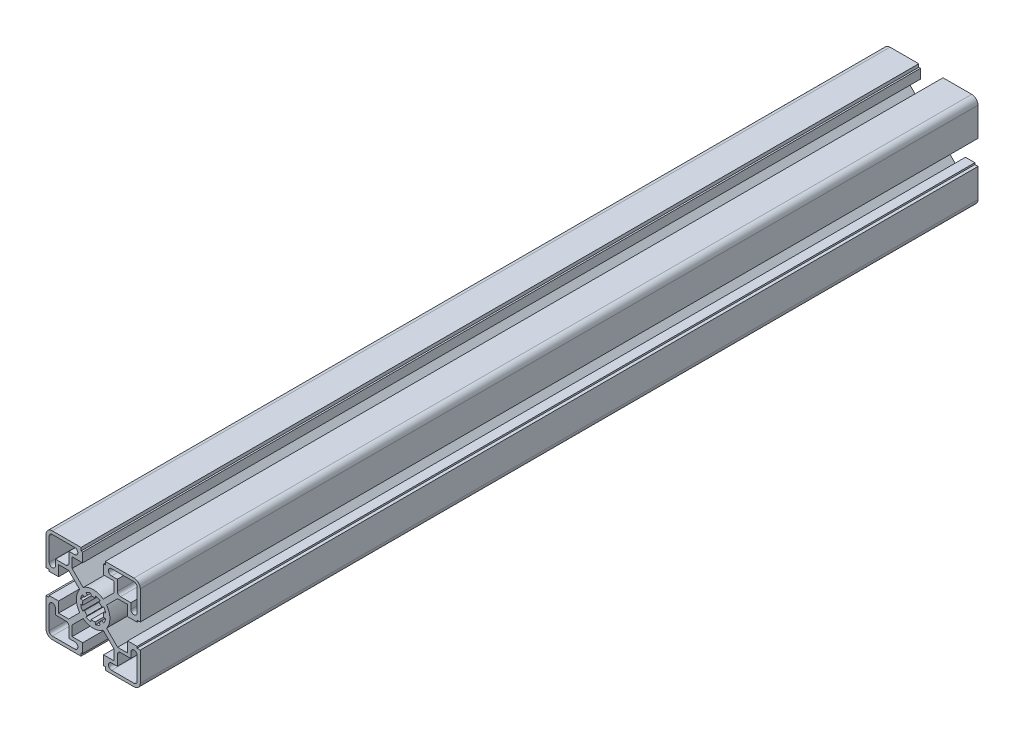
from build123d import *

# Parameters (mm, degrees)
BOSS_EXTRUDE1_DEPTH = 200


with BuildPart() as part:
    # Sketch1 → Boss-Extrude1 (new, symmetric)
    with BuildSketch(Plane.XY):
        with BuildLine():
            Line((-19.5072, 22.5044), (-5.7912, 22.5044))
            Line((-5.7912, 22.5044), (-5.7912, 21.0058))
            Line((-5.7912, 21.0058), (-5.0038, 21.0058))
            Line((-5.0038, 21.0058), (-5.0038, 16.51))
            Line((-5.0038, 16.51), (-10.0457, 16.51))
            Line((-10.0457, 16.51), (-10.0457, 11.680106614))
            Line((-10.0457, 11.680106614), (-4.781026704, 6.415433318))
            ThreePointArc((-4.781026704, 6.415433318), (0, 8.001), (4.781026704, 6.415433318))
            Line((4.781026704, 6.415433318), (10.0457, 11.680106614))
            Line((10.0457, 11.680106614), (10.0457, 16.51))
            Line((10.0457, 16.51), (5.0038, 16.51))
            Line((5.0038, 16.51), (5.0038, 21.0058))
            Line((5.0038, 21.0058), (5.7912, 21.0058))
            Line((5.7912, 21.0058), (5.7912, 22.5044))
            Line((5.7912, 22.5044), (19.5072, 22.5044))
            ThreePointArc((19.5072, 22.5044), (21.626540445, 21.626540445), (22.5044, 19.5072))
            Line((22.5044, 19.5072), (22.5044, 5.7912))
            Line((22.5044, 5.7912), (21.0058, 5.7912))
            Line((21.0058, 5.7912), (21.0058, 5.0038))
            Line((21.0058, 5.0038), (16.51, 5.0038))
            Line((16.51, 5.0038), (16.51, 10.0457))
            Line((16.51, 10.0457), (11.680106614, 10.0457))
            Line((11.680106614, 10.0457), (6.415433318, 4.781026704))
            ThreePointArc((6.415433318, 4.781026704), (8.001, 0), (6.415433318, -4.781026704))
            Line((6.415433318, -4.781026704), (11.680106614, -10.0457))
            Line((11.680106614, -10.0457), (16.51, -10.0457))
            Line((16.51, -10.0457), (16.51, -5.0038))
            Line((16.51, -5.0038), (21.0058, -5.0038))
            Line((21.0058, -5.0038), (21.0058, -5.7912))
            Line((21.0058, -5.7912), (22.5044, -5.7912))
            Line((22.5044, -5.7912), (22.5044, -19.5072))
            ThreePointArc((22.5044, -19.5072), (21.626540445, -21.626540445), (19.5072, -22.5044))
            Line((19.5072, -22.5044), (5.7912, -22.5044))
            Line((5.7912, -22.5044), (5.7912, -21.0058))
            Line((5.7912, -21.0058), (5.0038, -21.0058))
            Line((5.0038, -21.0058), (5.0038, -16.51))
            Line((5.0038, -16.51), (10.0457, -16.51))
            Line((10.0457, -16.51), (10.0457, -11.680106614))
            Line((10.0457, -11.680106614), (4.781026704, -6.415433318))
            ThreePointArc((4.781026704, -6.415433318), (0, -8.001), (-4.781026704, -6.415433318))
            Line((-4.781026704, -6.415433318), (-10.0457, -11.680106614))
            Line((-10.0457, -11.680106614), (-10.0457, -16.51))
            Line((-10.0457, -16.51), (-5.0038, -16.51))
            Line((-5.0038, -16.51), (-5.0038, -21.0058))
            Line((-5.0038, -21.0058), (-5.7912, -21.0058))
            Line((-5.7912, -21.0058), (-5.7912, -22.5044))
            Line((-5.7912, -22.5044), (-19.5072, -22.5044))
            ThreePointArc((-19.5072, -22.5044), (-21.626540445, -21.626540445), (-22.5044, -19.5072))
            Line((-22.5044, -19.5072), (-22.5044, -5.7912))
            Line((-22.5044, -5.7912), (-21.0058, -5.7912))
            Line((-21.0058, -5.7912), (-21.0058, -5.0038))
            Line((-21.0058, -5.0038), (-16.51, -5.0038))
            Line((-16.51, -5.0038), (-16.51, -10.0457))
            Line((-16.51, -10.0457), (-11.680106614, -10.0457))
            Line((-11.680106614, -10.0457), (-6.415433318, -4.781026704))
            ThreePointArc((-6.415433318, -4.781026704), (-8.001, 0), (-6.415433318, 4.781026704))
            Line((-6.415433318, 4.781026704), (-11.680106614, 10.0457))
            Line((-11.680106614, 10.0457), (-16.51, 10.0457))
            Line((-16.51, 10.0457), (-16.51, 5.0038))
            Line((-16.51, 5.0038), (-21.0058, 5.0038))
            Line((-21.0058, 5.0038), (-21.0058, 5.7912))
            Line((-21.0058, 5.7912), (-22.5044, 5.7912))
            Line((-22.5044, 5.7912), (-22.5044, 19.5072))
            ThreePointArc((-22.5044, 19.5072), (-21.626540445, 21.626540445), (-19.5072, 22.5044))
        make_face()
        with BuildLine():
            Line((-18.0086, 11.5443), (-13.0429, 11.5443))
            ThreePointArc((-13.0429, 11.5443), (-11.983229778, 11.983229778), (-11.5443, 13.0429))
            Line((-11.5443, 13.0429), (-11.5443, 18.0086))
            Line((-11.5443, 18.0086), (-8.7884, 18.0086))
            ThreePointArc((-8.7884, 18.0086), (-7.2898, 19.5072), (-8.7884, 21.0058))
            Line((-8.7884, 21.0058), (-19.5072, 21.0058))
            ThreePointArc((-19.5072, 21.0058), (-20.566870222, 20.566870222), (-21.0058, 19.5072))
            Line((-21.0058, 19.5072), (-21.0058, 8.7884))
            ThreePointArc((-21.0058, 8.7884), (-19.5072, 7.2898), (-18.0086, 8.7884))
            Line((-18.0086, 8.7884), (-18.0086, 11.5443))
        make_face(mode=Mode.SUBTRACT)
        with BuildLine():
            Line((1.189270603, 5.978867069), (0.976192953, 4.907653386))
            ThreePointArc((0.976192953, 4.907653386), (0, 5.0038), (-0.976192953, 4.907653386))
            Line((-0.976192953, 4.907653386), (-1.189270603, 5.978867069))
            ThreePointArc((-1.189270603, 5.978867069), (-2.332838204, 5.63196963), (-3.38675614, 5.068638757))
            Line((-3.38675614, 5.068638757), (-2.779962332, 4.160507646))
            ThreePointArc((-2.779962332, 4.160507646), (-3.538220912, 3.538220912), (-4.160507646, 2.779962332))
            Line((-4.160507646, 2.779962332), (-5.068638757, 3.38675614))
            ThreePointArc((-5.068638757, 3.38675614), (-5.63196963, 2.332838204), (-5.978867069, 1.189270603))
            Line((-5.978867069, 1.189270603), (-4.907653386, 0.976192953))
            ThreePointArc((-4.907653386, 0.976192953), (-5.0038, 0), (-4.907653386, -0.976192953))
            Line((-4.907653386, -0.976192953), (-5.978867069, -1.189270603))
            ThreePointArc((-5.978867069, -1.189270603), (-5.63196963, -2.332838204), (-5.068638757, -3.38675614))
            Line((-5.068638757, -3.38675614), (-4.160507646, -2.779962332))
            ThreePointArc((-4.160507646, -2.779962332), (-3.538220912, -3.538220912), (-2.779962332, -4.160507646))
            Line((-2.779962332, -4.160507646), (-3.38675614, -5.068638757))
            ThreePointArc((-3.38675614, -5.068638757), (-2.332838204, -5.63196963), (-1.189270603, -5.978867069))
            Line((-1.189270603, -5.978867069), (-0.976192953, -4.907653386))
            ThreePointArc((-0.976192953, -4.907653386), (0, -5.0038), (0.976192953, -4.907653386))
            Line((0.976192953, -4.907653386), (1.189270603, -5.978867069))
            ThreePointArc((1.189270603, -5.978867069), (2.332838204, -5.63196963), (3.38675614, -5.068638757))
            Line((3.38675614, -5.068638757), (2.779962332, -4.160507646))
            ThreePointArc((2.779962332, -4.160507646), (3.538220912, -3.538220912), (4.160507646, -2.779962332))
            Line((4.160507646, -2.779962332), (5.068638757, -3.38675614))
            ThreePointArc((5.068638757, -3.38675614), (5.63196963, -2.332838204), (5.978867069, -1.189270603))
            Line((5.978867069, -1.189270603), (4.907653386, -0.976192953))
            ThreePointArc((4.907653386, -0.976192953), (5.0038, 0), (4.907653386, 0.976192953))
            Line((4.907653386, 0.976192953), (5.978867069, 1.189270603))
            ThreePointArc((5.978867069, 1.189270603), (5.63196963, 2.332838204), (5.068638757, 3.38675614))
            Line((5.068638757, 3.38675614), (4.160507646, 2.779962332))
            ThreePointArc((4.160507646, 2.779962332), (3.538220912, 3.538220912), (2.779962332, 4.160507646))
            Line((2.779962332, 4.160507646), (3.38675614, 5.068638757))
            ThreePointArc((3.38675614, 5.068638757), (2.332838204, 5.63196963), (1.189270603, 5.978867069))
        make_face(mode=Mode.SUBTRACT)
        with BuildLine():
            Line((11.5443, 18.0086), (8.7884, 18.0086))
            ThreePointArc((8.7884, 18.0086), (7.2898, 19.5072), (8.7884, 21.0058))
            Line((8.7884, 21.0058), (19.5072, 21.0058))
            ThreePointArc((19.5072, 21.0058), (20.566870222, 20.566870222), (21.0058, 19.5072))
            Line((21.0058, 19.5072), (21.0058, 8.7884))
            ThreePointArc((21.0058, 8.7884), (19.5072, 7.2898), (18.0086, 8.7884))
            Line((18.0086, 8.7884), (18.0086, 11.5443))
            Line((18.0086, 11.5443), (13.0429, 11.5443))
            ThreePointArc((13.0429, 11.5443), (11.983229778, 11.983229778), (11.5443, 13.0429))
            Line((11.5443, 13.0429), (11.5443, 18.0086))
        make_face(mode=Mode.SUBTRACT)
        with BuildLine():
            Line((18.0086, -11.5443), (13.0429, -11.5443))
            ThreePointArc((13.0429, -11.5443), (11.983229778, -11.983229778), (11.5443, -13.0429))
            Line((11.5443, -13.0429), (11.5443, -18.0086))
            Line((11.5443, -18.0086), (8.7884, -18.0086))
            ThreePointArc((8.7884, -18.0086), (7.2898, -19.5072), (8.7884, -21.0058))
            Line((8.7884, -21.0058), (19.5072, -21.0058))
            ThreePointArc((19.5072, -21.0058), (20.566870222, -20.566870222), (21.0058, -19.5072))
            Line((21.0058, -19.5072), (21.0058, -8.7884))
            ThreePointArc((21.0058, -8.7884), (19.5072, -7.2898), (18.0086, -8.7884))
            Line((18.0086, -8.7884), (18.0086, -11.5443))
        make_face(mode=Mode.SUBTRACT)
        with BuildLine():
            Line((-11.5443, -18.0086), (-8.7884, -18.0086))
            ThreePointArc((-8.7884, -18.0086), (-7.2898, -19.5072), (-8.7884, -21.0058))
            Line((-8.7884, -21.0058), (-19.5072, -21.0058))
            ThreePointArc((-19.5072, -21.0058), (-20.566870222, -20.566870222), (-21.0058, -19.5072))
            Line((-21.0058, -19.5072), (-21.0058, -8.7884))
            ThreePointArc((-21.0058, -8.7884), (-19.5072, -7.2898), (-18.0086, -8.7884))
            Line((-18.0086, -8.7884), (-18.0086, -11.5443))
            Line((-18.0086, -11.5443), (-13.0429, -11.5443))
            ThreePointArc((-13.0429, -11.5443), (-11.983229778, -11.983229778), (-11.5443, -13.0429))
            Line((-11.5443, -13.0429), (-11.5443, -18.0086))
        make_face(mode=Mode.SUBTRACT)
    extrude(amount=BOSS_EXTRUDE1_DEPTH, both=True)


solid = part.part
